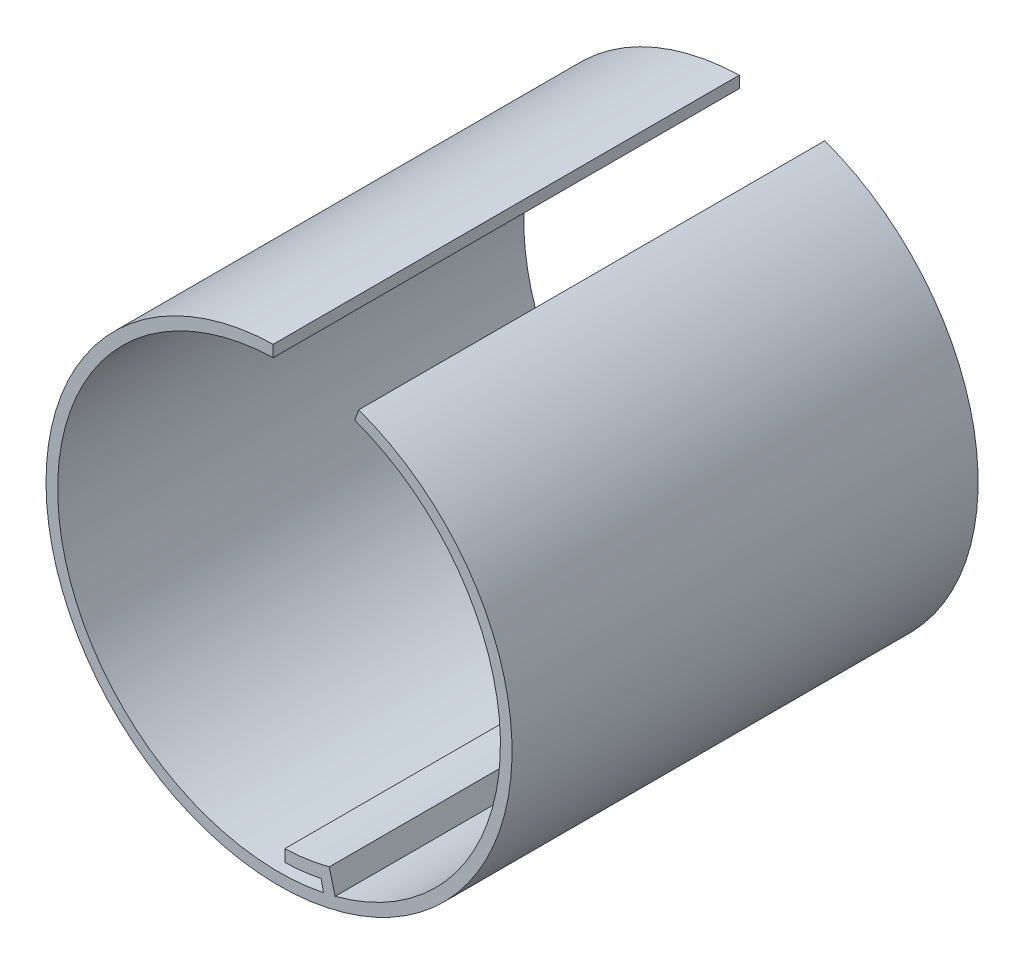
from build123d import *

# Parameters (mm, degrees)
BOSS_EXTRUDE1_DEPTH = 101.6


with BuildPart() as part:
    # Sketch1 → Boss-Extrude1 (new body)
    with BuildSketch(Plane.XY):
        with BuildLine():
            Line((-1.27, 50.784122519), (-1.27, 48.24328658))
            ThreePointArc((-1.27, 48.24328658), (-48.255821464, -0.635054985), (0, -48.26))
            ThreePointArc((0, -48.26), (4.873264732, -48.013319932), (9.696710265, -47.275801527))
            Line((9.696710265, -47.275801527), (9.201166175, -44.859802346))
            ThreePointArc((9.201166175, -44.859802346), (5.255589984, -45.491121106), (1.27, -45.776090108))
            Line((1.27, -45.776090108), (1.27, -43.161319489))
            ThreePointArc((1.27, -43.161319489), (6.147836333, -42.740104216), (10.946634308, -41.769409827))
            Line((10.946634308, -41.769409827), (12.234473638, -46.683458042))
            ThreePointArc((12.234473638, -46.683458042), (48.208106465, -2.237425089), (16.505892117, 45.349565879))
            Line((16.505892117, 45.349565879), (17.374623281, 47.736385136))
            ThreePointArc((17.374623281, 47.736385136), (-8.195236332, -50.134599843), (-1.27, 50.784122519))
        make_face()
    extrude(amount=BOSS_EXTRUDE1_DEPTH)


solid = part.part
